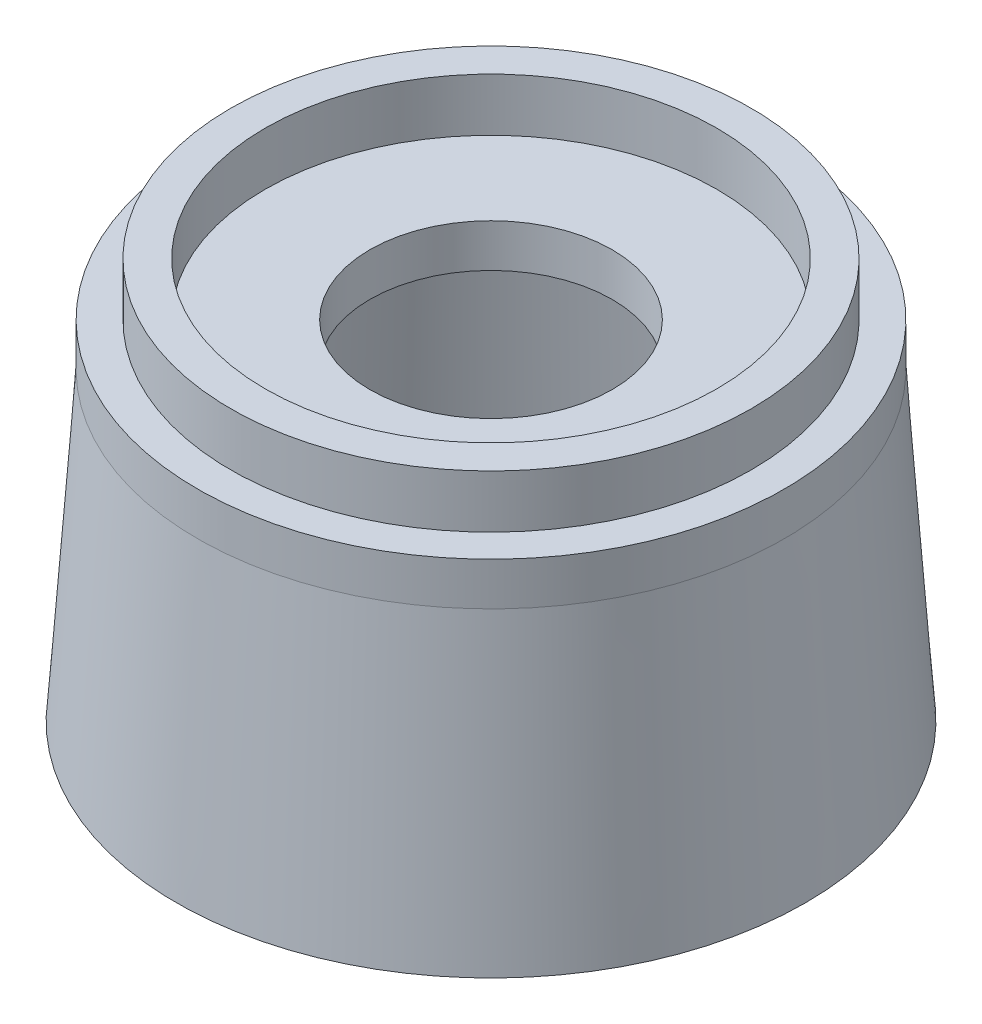
from build123d import *

# Parameters (mm, degrees)
ESQUISSE1_W        = 15.8
ESQUISSE1_H        = 6.5
ESQUISSE1_W_2      = 5.2
ESQUISSE1_H_2      = 8
ESQUISSE2_W        = 2
ESQUISSE2_H        = 2.5
BOSS_EXTRU_2_DEPTH = 25
ESQUISSE3_W        = 2.5
ESQUISSE3_H        = 2
ESQUISSE3_W_2      = 2
ESQUISSE3_H_2      = 2.5
BOSS_EXTRU_3_DEPTH = 25


with BuildPart() as part:
    # Esquisse1 → Révolution1 (revolve)
    with BuildSketch(Plane.XY, mode=Mode.PRIVATE) as r_volution1_sk:
        Polygon((32.884729147, 39.302631579), (29.884729147, 39.302631579), (33.372699072, -6.697368421), (36.084729147, -6.697368421), align=None)
        Polygon((27.884729147, 45.802631579), (22.684729147, 45.802631579), (22.684729147, 39.302631579), (29.884729147, 39.302631579), (32.884729147, 39.302631579), (32.884729147, 45.802631579), align=None)
        with Locations((14.784729147, 42.552631579)):
            Rectangle(ESQUISSE1_W, ESQUISSE1_H)
        with Locations((25.284729147, 49.802631579)):
            Rectangle(ESQUISSE1_W_2, ESQUISSE1_H_2)
    revolve(r_volution1_sk.sketch.rotate(Axis((-11.415270853, 52.302631579, 0), (0, -1, 0)), 180), axis=Axis((-11.415270853, 52.302631579, 0), (0, -1, 0)))

    # Esquisse2 → Boss.-Extru.2 (add)
    with BuildSketch(Plane.XZ.offset(-39.302631579)):
        with Locations((-11.124553999, -41.298976788)):
            Rectangle(ESQUISSE2_W, ESQUISSE2_H)
    extrude(amount=BOSS_EXTRU_2_DEPTH)

    # Esquisse3 → Boss.-Extru.3 (add)
    with BuildSketch(Plane.XZ.offset(-39.302631579)):
        with Locations((-52.710541461, -0.6250003)):
            Rectangle(ESQUISSE3_W, ESQUISSE3_H)
        with Locations((-11.706072968, 41.298976187)):
            Rectangle(ESQUISSE3_W_2, ESQUISSE3_H_2)
    extrude(amount=BOSS_EXTRU_3_DEPTH)


solid = part.part
